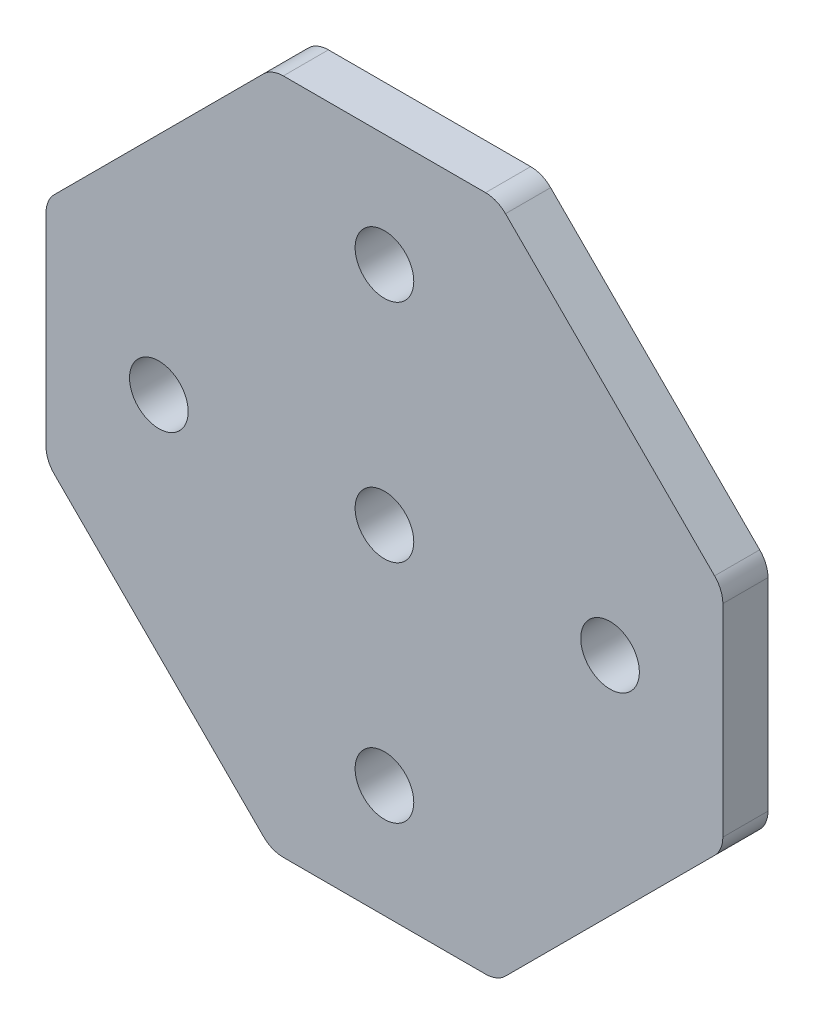
from build123d import *

# Parameters (mm, degrees)
SKETCH_1_R      = 2.6
EXTRUDE_1_DEPTH = 4


with BuildPart() as part:
    # Эскиз1 → Бобышка-Вытянуть1 (new body)
    with BuildSketch(Plane.XY):
        with BuildLine():
            Line((0, 1.035533906), (0, 18.964466094))
            ThreePointArc((0, 18.964466094), (0.190301169, 19.921174675), (0.732233047, 20.732233047))
            Line((0.732233047, 20.732233047), (19.267766953, 39.267766953))
            ThreePointArc((19.267766953, 39.267766953), (20.078825325, 39.809698831), (21.035533906, 40))
            Line((21.035533906, 40), (38.964466094, 40))
            ThreePointArc((38.964466094, 40), (39.921174675, 39.809698831), (40.732233047, 39.267766953))
            Line((40.732233047, 39.267766953), (59.267766953, 20.732233047))
            ThreePointArc((59.267766953, 20.732233047), (59.809698831, 19.921174675), (60, 18.964466094))
            Line((60, 18.964466094), (60, 1.035533906))
            ThreePointArc((60, 1.035533906), (59.809698831, 0.078825325), (59.267766953, -0.732233047))
            Line((59.267766953, -0.732233047), (40.732233047, -19.267766953))
            ThreePointArc((40.732233047, -19.267766953), (39.921174675, -19.809698831), (38.964466094, -20))
            Line((38.964466094, -20), (21.035533906, -20))
            ThreePointArc((21.035533906, -20), (20.078825325, -19.809698831), (19.267766953, -19.267766953))
            Line((19.267766953, -19.267766953), (0.732233047, -0.732233047))
            ThreePointArc((0.732233047, -0.732233047), (0.190301169, 0.078825325), (0, 1.035533906))
        make_face()
        with Locations((10, 10)):
            Circle(SKETCH_1_R, mode=Mode.SUBTRACT)
        with Locations((30, 10)):
            Circle(SKETCH_1_R, mode=Mode.SUBTRACT)
        with Locations((50, 10)):
            Circle(SKETCH_1_R, mode=Mode.SUBTRACT)
        with Locations((30, 30)):
            Circle(SKETCH_1_R, mode=Mode.SUBTRACT)
        with Locations((30, -10)):
            Circle(SKETCH_1_R, mode=Mode.SUBTRACT)
    extrude(amount=EXTRUDE_1_DEPTH)


solid = part.part
